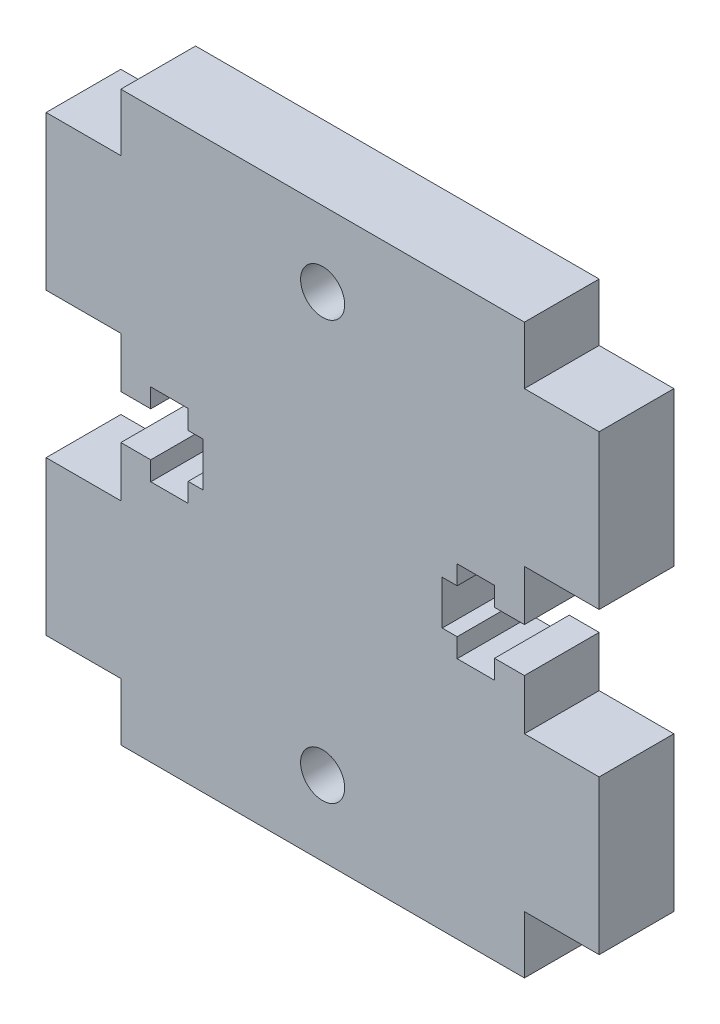
from build123d import *

# Parameters (mm, degrees)
SKETCH1_R           = 1.475
BOSS_EXTRUDE1_DEPTH = 5


with BuildPart() as part:
    # Sketch1 → Boss-Extrude1 (new body)
    with BuildSketch(Plane.XY):
        Polygon((-13.5, 19), (13.5, 19), (13.5, 15.15), (18.5, 15.15), (18.5, 4.85), (13.5, 4.85), (13.5, 1.475), (11.5, 1.475), (11.5, 2.75), (9, 2.75), (9, 1.475), (8, 1.475), (8, -1.475), (9, -1.475), (9, -2.75), (11.5, -2.75), (11.5, -1.475), (13.5, -1.475), (13.5, -4.85), (18.5, -4.85), (18.5, -15.15), (13.5, -15.15), (13.5, -19), (-13.5, -19), (-13.5, -15.15), (-18.5, -15.15), (-18.5, -4.85), (-13.5, -4.85), (-13.5, -1.475), (-11.5, -1.475), (-11.5, -2.75), (-9, -2.75), (-9, -1.475), (-8, -1.475), (-8, 1.475), (-9, 1.475), (-9, 2.75), (-11.5, 2.75), (-11.5, 1.475), (-13.5, 1.475), (-13.5, 4.85), (-18.5, 4.85), (-18.5, 15.15), (-13.5, 15.15), align=None)
        with Locations((0, 14)):
            Circle(SKETCH1_R, mode=Mode.SUBTRACT)
        with Locations(Location((0, -14, 0), (0, 0, 180))):
            Circle(SKETCH1_R, mode=Mode.SUBTRACT)
    extrude(amount=BOSS_EXTRUDE1_DEPTH)


solid = part.part
